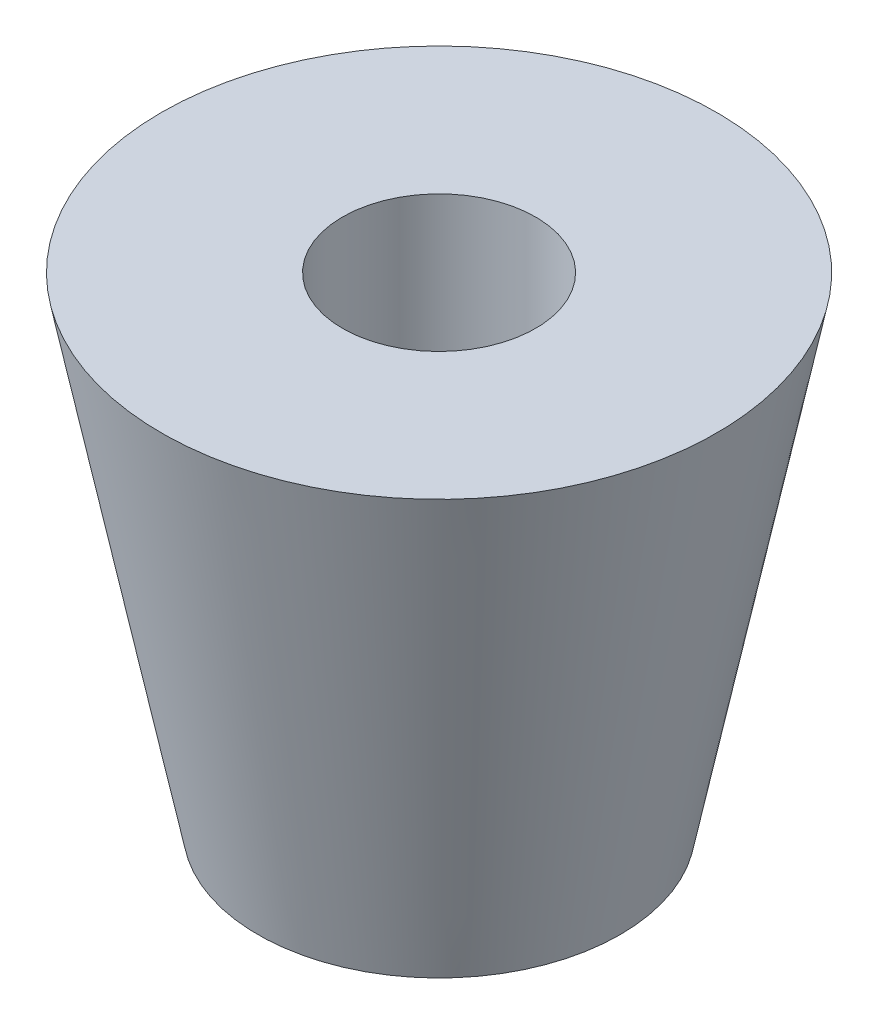
from build123d import *

# Parameters (mm, degrees)
ESQUISSE3_R             = 4
ENL_V_MAT_EXTRU_1_DEPTH = 26.777897509


with BuildPart() as part:
    # Esquisse1 → Révolution1 (revolve)
    with BuildSketch(Plane.XY, mode=Mode.PRIVATE) as r_volution1_sk:
        Polygon((0, 0), (11.5, 0), (7.5, -20), (0, -20), align=None)
    revolve(r_volution1_sk.sketch.rotate(Axis((0, 33.610182079, 0), (0, -1, 0)), 180), axis=Axis((0, 33.610182079, 0), (0, -1, 0)))

    # Esquisse3 → Enlèv. mat.-Extru.1 (cut, through all)
    with BuildSketch(Plane(origin=(0, 0, 0), x_dir=(1, 0, 0), z_dir=(0, 1, 0))):
        with Locations(Location((0, 0, 0), (0, 0, 180))):
            Circle(ESQUISSE3_R)
    extrude(amount=-ENL_V_MAT_EXTRU_1_DEPTH, mode=Mode.SUBTRACT)


solid = part.part
